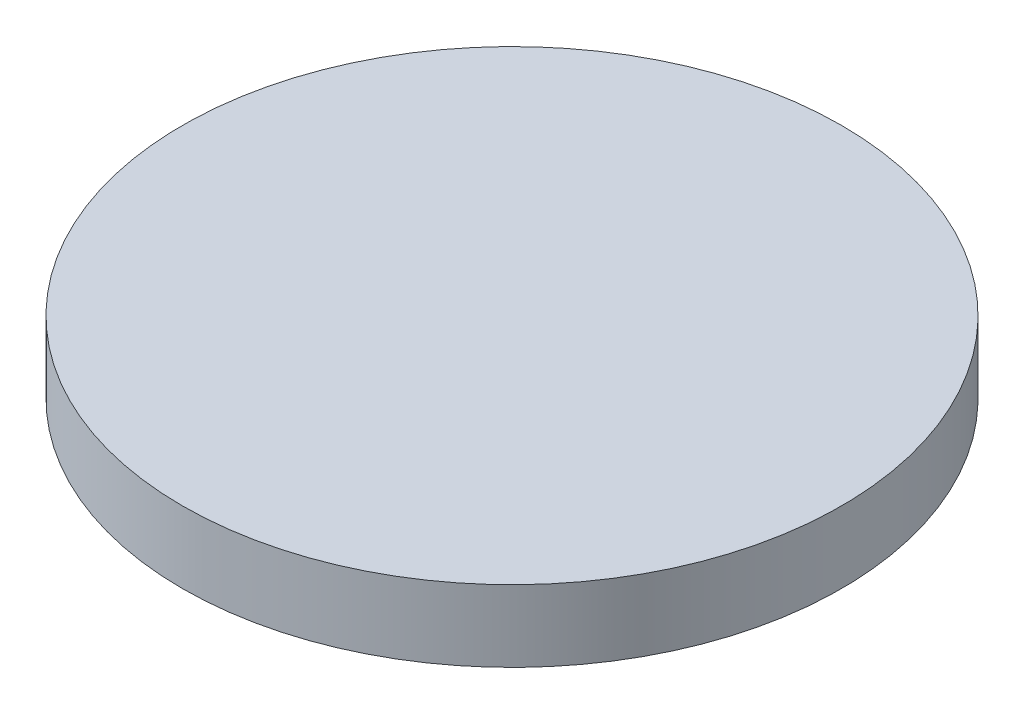
from build123d import *

# Parameters (mm, degrees)
SKETCH1_R           = 4.6
BOSS_EXTRUDE1_DEPTH = 1


with BuildPart() as part:
    # Sketch1 → Boss-Extrude1 (new body)
    with BuildSketch(Plane(origin=(0, 0, 0), x_dir=(1, 0, 0), z_dir=(0, 1, 0))):
        with Locations(Location((0, 0, 0), (0, 0, 270))):
            Circle(SKETCH1_R)
    extrude(amount=BOSS_EXTRUDE1_DEPTH)


solid = part.part
